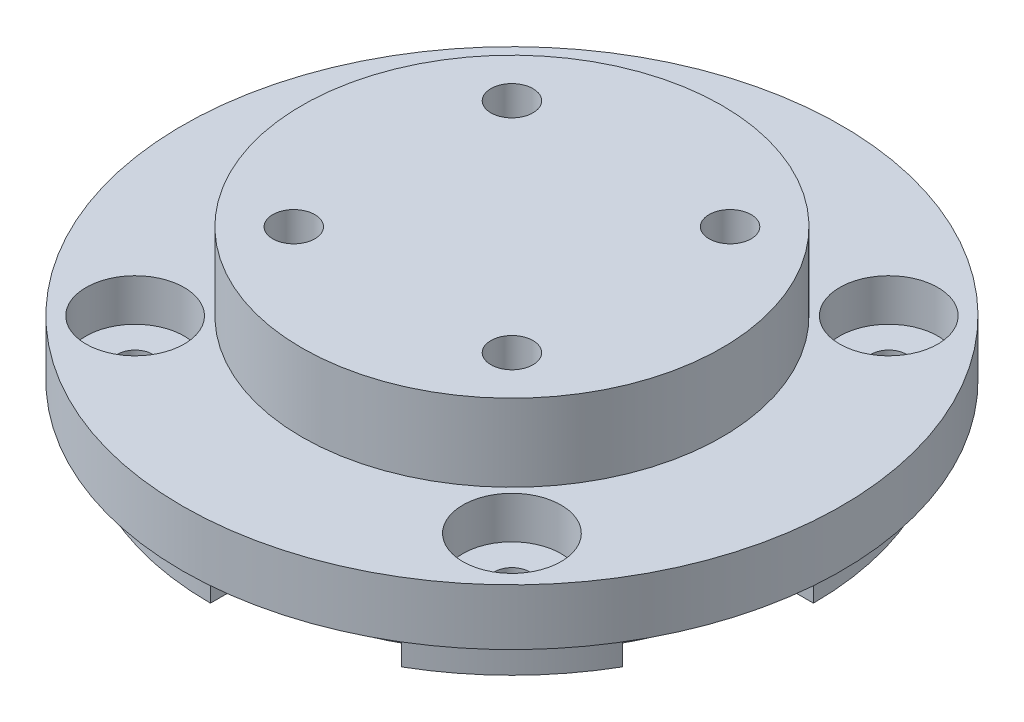
from build123d import *

# Parameters (mm, degrees)
SKETCH_2_R           = 21.5
EXTRUDE_1_DEPTH      = 7
SKETCH_3_R           = 23.5
EXTRUDE_2_DEPTH      = 4
SKETCH_6_R           = 1.25
SKETCH_6_R_2         = 8
CUT_EXTRUDE_1_DEPTH  = 15
SKETCH_9_R           = 14.98
SKETCH_9_R_2         = 14.02
EXTRUDE_3_DEPTH      = 5.5
SKETCH_7_R           = 3.5
CUT_EXTRUDE_3_DEPTH  = 3
SKETCH_10_R          = 1.25
CUT_EXTRUDE_4_DEPTH  = 22
CUT_EXTRUDE_5_DEPTH  = 3
SKETCH_12_R          = 14.02
SKETCH_12_R_2        = 1.5
EXTRUDE_4_DEPTH      = 5.5
CUT_EXTRUDE_START    = -3
SKETCH_13_R          = 14.48
CUT_EXTRUDE_10_DEPTH = 33.507041555


with BuildPart() as part:
    # 草图2 → 凸台-拉伸1 (new body)
    with BuildSketch(Plane(origin=(0, 0, 0), x_dir=(1, 0, 0), z_dir=(0, 1, 0))):
        with Locations(Location((0, 0, 0), (0, 0, 270))):
            Circle(SKETCH_2_R)
    extrude(amount=EXTRUDE_1_DEPTH)

    # 草图3 → 凸台-拉伸2 (add)
    with BuildSketch(Plane(origin=(0, 7, 0), x_dir=(1, 0, 0), z_dir=(0, 1, 0))):
        with Locations(Location((0, 0, 0), (0, 0, 270))):
            Circle(SKETCH_3_R)
    extrude(amount=-EXTRUDE_2_DEPTH)

    # 草图6 → 切除-拉伸1 (cut)
    with BuildSketch(Plane(origin=(0, 7, 0), x_dir=(1, 0, 0), z_dir=(0, 1, 0))):
        with Locations(Location((13.435028843, 13.435028843, 0), (0, 0, 270))):
            Circle(SKETCH_6_R)
        with Locations(Location((13.435028843, -13.435028843, 0), (0, 0, 270))):
            Circle(SKETCH_6_R)
        with Locations(Location((-13.435028843, -13.435028843, 0), (0, 0, 270))):
            Circle(SKETCH_6_R)
        with Locations(Location((-13.435028843, 13.435028843, 0), (0, 0, 270))):
            Circle(SKETCH_6_R)
        with Locations(Location((0, 0, 0), (0, 0, 270))):
            Circle(SKETCH_6_R_2)
    extrude(amount=-CUT_EXTRUDE_1_DEPTH, mode=Mode.SUBTRACT)

    # 草图9 → 凸台-拉伸3 (add)
    with BuildSketch(Plane(origin=(0, 7, 0), x_dir=(1, 0, 0), z_dir=(0, 1, 0))):
        with Locations(Location((0, 0, 0), (0, 0, 270))):
            Circle(SKETCH_9_R)
        with Locations(Location((0, 0, 0), (0, 0, 270))):
            Circle(SKETCH_9_R_2, mode=Mode.SUBTRACT)
    extrude(amount=EXTRUDE_3_DEPTH)

    # 草图7 → 切除-拉伸3 (cut)
    with BuildSketch(Plane(origin=(0, 7, 0), x_dir=(1, 0, 0), z_dir=(0, 1, 0))):
        with Locations(Location((-13.435028843, 13.435028843, 0), (0, 0, 270))):
            Circle(SKETCH_7_R)
        with Locations(Location((13.435028843, 13.435028843, 0), (0, 0, 270))):
            Circle(SKETCH_7_R)
        with Locations(Location((13.435028843, -13.435028843, 0), (0, 0, 270))):
            Circle(SKETCH_7_R)
        with Locations(Location((-13.435028843, -13.435028843, 0), (0, 0, 270))):
            Circle(SKETCH_7_R)
    extrude(amount=-CUT_EXTRUDE_3_DEPTH, mode=Mode.SUBTRACT)

    # 草图10 → 切除-拉伸4 (cut)
    with BuildSketch(Plane(origin=(0, 7, 0), x_dir=(1, 0, 0), z_dir=(0, 1, 0))):
        with Locations(Location((7.778174593, 7.778174593, 0), (0, 0, 270))):
            Circle(SKETCH_10_R)
        with Locations(Location((7.778174593, -7.778174593, 0), (0, 0, 270))):
            Circle(SKETCH_10_R)
        with Locations(Location((-7.778174593, -7.778174593, 0), (0, 0, 270))):
            Circle(SKETCH_10_R)
        with Locations(Location((-7.778174593, 7.778174593, 0), (0, 0, 270))):
            Circle(SKETCH_10_R)
    extrude(amount=-CUT_EXTRUDE_4_DEPTH, mode=Mode.SUBTRACT)

    # 草图11 → 切除-拉伸5 (cut)
    with BuildSketch(Plane.XZ):
        with BuildLine():
            Line((18.619546181, 10.75), (16.887495374, 9.75))
            ThreePointArc((16.887495374, 9.75), (18.835553613, 5.046971379), (19.5, 0))
            Line((19.5, 0), (21.5, 0))
            ThreePointArc((21.5, 0), (20.767405265, 5.56460947), (18.619546181, 10.75))
        make_face()
        with BuildLine():
            Line((0, 21.5), (0, 19.5))
            ThreePointArc((0, 19.5), (5.046971379, 18.835553613), (9.75, 16.887495374))
            Line((9.75, 16.887495374), (10.75, 18.619546181))
            ThreePointArc((10.75, 18.619546181), (5.56460947, 20.767405265), (0, 21.5))
        make_face()
    extrude(amount=-CUT_EXTRUDE_5_DEPTH, mode=Mode.SUBTRACT)

    # 草图12 → 凸台-拉伸4 (add)
    with BuildSketch(Plane(origin=(0, 7, 0), x_dir=(1, 0, 0), z_dir=(0, 1, 0))):
        Circle(SKETCH_12_R)
        with Locations(Location((7.778174593, 7.778174593, 0), (0, 0, 270))):
            Circle(SKETCH_12_R_2, mode=Mode.SUBTRACT)
        with Locations(Location((7.778174593, -7.778174593, 0), (0, 0, 270))):
            Circle(SKETCH_12_R_2, mode=Mode.SUBTRACT)
        with Locations(Location((-7.778174593, -7.778174593, 0), (0, 0, 270))):
            Circle(SKETCH_12_R_2, mode=Mode.SUBTRACT)
        with Locations(Location((-7.778174593, 7.778174593, 0), (0, 0, 270))):
            Circle(SKETCH_12_R_2, mode=Mode.SUBTRACT)
    extrude(amount=EXTRUDE_4_DEPTH)

    # 草图13 → 切除-拉伸10 (cut, through all)
    with BuildSketch(Plane(origin=(0, 12.5, 0), x_dir=(1, 0, 0), z_dir=(0, 1, 0)).offset(CUT_EXTRUDE_START)):
        with Locations(Location((0, 0, 0), (0, 0, 270))):
            Circle(SKETCH_13_R)
    extrude(amount=-CUT_EXTRUDE_10_DEPTH, mode=Mode.SUBTRACT)


solid = part.part
